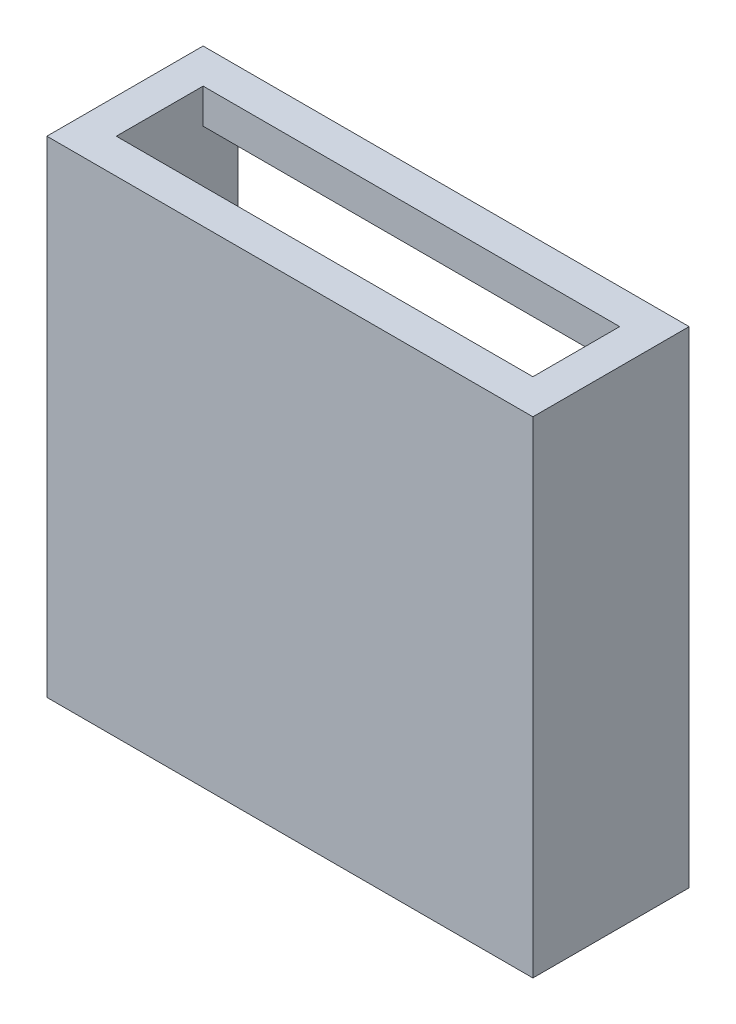
from build123d import *

# Parameters (mm, degrees)
SKETCH_1_W          = 28
SKETCH_1_H          = 28
EXTRUDE_1_DEPTH     = 2
SKETCH_2_W          = 28
SKETCH_2_H          = 28
SKETCH_2_W_2        = 24
SKETCH_2_H_2        = 24
EXTRUDE_2_DEPTH     = 7
SKETCH_3_W          = 24
SKETCH_3_H          = 5
CUT_EXTRUDE_1_DEPTH = 33.078029865
EXTRUDE_3_DEPTH     = 3.5
EXTRUDE_4_DEPTH     = 4


with BuildPart() as part:
    # Эскиз1 → Бобышка-Вытянуть1 (new body)
    with BuildSketch(Plane.XY):
        Rectangle(SKETCH_1_W, SKETCH_1_H)
    extrude(amount=EXTRUDE_1_DEPTH)

    # Эскиз2 → Бобышка-Вытянуть2 (add)
    with BuildSketch(Plane(origin=(0, 0, 0), x_dir=(-1, 0, 0), z_dir=(0, 0, -1))):
        Rectangle(SKETCH_2_W, SKETCH_2_H)
        Rectangle(SKETCH_2_W_2, SKETCH_2_H_2, mode=Mode.SUBTRACT)
    extrude(amount=EXTRUDE_2_DEPTH)

    # Эскиз3 → Вырез-Вытянуть1 (cut, through all)
    with BuildSketch(Plane(origin=(0, 14, 0), x_dir=(1, 0, 0), z_dir=(0, 1, 0))):
        with Locations((0, 2.5)):
            Rectangle(SKETCH_3_W, SKETCH_3_H)
    extrude(amount=-CUT_EXTRUDE_1_DEPTH, mode=Mode.SUBTRACT)

    # Эскиз4 → Бобышка-Вытянуть3 (add)
    with BuildSketch(Plane(origin=(0, 0, 0), x_dir=(-1, 0, 0), z_dir=(0, 0, -1))):
        with BuildLine():
            Line((-1.965063509, -1.596410162), (0, -0.461880215))
            Line((0, -0.461880215), (-0.2, -0.346410162))
            ThreePointArc((-0.2, -0.346410162), (-0.346410162, -0.2), (-0.4, 0))
            Line((-0.4, 0), (-0.4, 0.230940108))
            Line((-0.4, 0.230940108), (-2.365063509, -0.903589838))
            Line((-2.365063509, -0.903589838), (-1.965063509, -1.596410162))
        make_face()
        with BuildLine():
            Line((0, -0.461880215), (1.965063509, -1.596410162))
            Line((1.965063509, -1.596410162), (2.365063509, -0.903589838))
            Line((2.365063509, -0.903589838), (0.4, 0.230940108))
            Line((0.4, 0.230940108), (0.4, 0))
            ThreePointArc((0.4, 0), (0.346410162, -0.2), (0.2, -0.346410162))
            Line((0.2, -0.346410162), (0, -0.461880215))
        make_face()
        with BuildLine():
            Line((0.2, 0.346410162), (0.4, 0.230940108))
            Line((0.4, 0.230940108), (0.4, 2.5))
            Line((0.4, 2.5), (-0.4, 2.5))
            Line((-0.4, 2.5), (-0.4, 0.230940108))
            Line((-0.4, 0.230940108), (-0.2, 0.346410162))
            ThreePointArc((-0.2, 0.346410162), (0, 0.4), (0.2, 0.346410162))
        make_face()
        with BuildLine():
            Line((0, 0), (-0.2, -0.346410162))
            ThreePointArc((-0.2, -0.346410162), (0, -0.4), (0.2, -0.346410162))
            Line((0.2, -0.346410162), (0, 0))
        make_face()
        with BuildLine():
            Line((-0.2, 0.346410162), (0, 0))
            Line((0, 0), (0.2, 0.346410162))
            ThreePointArc((0.2, 0.346410162), (0, 0.4), (-0.2, 0.346410162))
        make_face()
        with BuildLine():
            Line((0, 0), (0.2, -0.346410162))
            ThreePointArc((0.2, -0.346410162), (0.346410162, -0.2), (0.4, 0))
            Line((0.4, 0), (0, 0))
        make_face()
        with BuildLine():
            Line((-0.4, 0), (0, 0))
            Line((0, 0), (-0.2, 0.346410162))
            ThreePointArc((-0.2, 0.346410162), (-0.346410162, 0.2), (-0.4, 0))
        make_face()
        with BuildLine():
            ThreePointArc((-0.4, 0), (-0.346410162, -0.2), (-0.2, -0.346410162))
            Line((-0.2, -0.346410162), (0, 0))
            Line((0, 0), (-0.4, 0))
        make_face()
        with BuildLine():
            Line((0.2, 0.346410162), (0, 0))
            Line((0, 0), (0.4, 0))
            ThreePointArc((0.4, 0), (0.346410162, 0.2), (0.2, 0.346410162))
        make_face()
        with BuildLine():
            Line((-0.2, -0.346410162), (0, -0.461880215))
            Line((0, -0.461880215), (0.2, -0.346410162))
            ThreePointArc((0.2, -0.346410162), (0, -0.4), (-0.2, -0.346410162))
        make_face()
        with BuildLine():
            Line((0.4, 0), (0.4, 0.230940108))
            Line((0.4, 0.230940108), (0.2, 0.346410162))
            ThreePointArc((0.2, 0.346410162), (0.346410162, 0.2), (0.4, 0))
        make_face()
        with BuildLine():
            Line((-0.4, 0.230940108), (-0.4, 0))
            ThreePointArc((-0.4, 0), (-0.346410162, 0.2), (-0.2, 0.346410162))
            Line((-0.2, 0.346410162), (-0.4, 0.230940108))
        make_face()
    extrude(amount=EXTRUDE_3_DEPTH)

    # Эскиз6 → Бобышка-Вытянуть4 (add, symmetric)
    with BuildSketch(Plane(origin=(0, 0, 0), x_dir=(1, 0, 0), z_dir=(0, 1, 0))):
        Polygon((-12, 6), (-10.5, 4), (-12, 4), align=None)
    extrude_4 = extrude(amount=EXTRUDE_4_DEPTH, both=True)

    # Зеркальное отражение1: Бобышка-Вытянуть4 across plane
    add(extrude_4.mirror(Plane(origin=(0, 0, 0), x_dir=(0, 0, 1), z_dir=(1, 0, 0))))


solid = part.part
